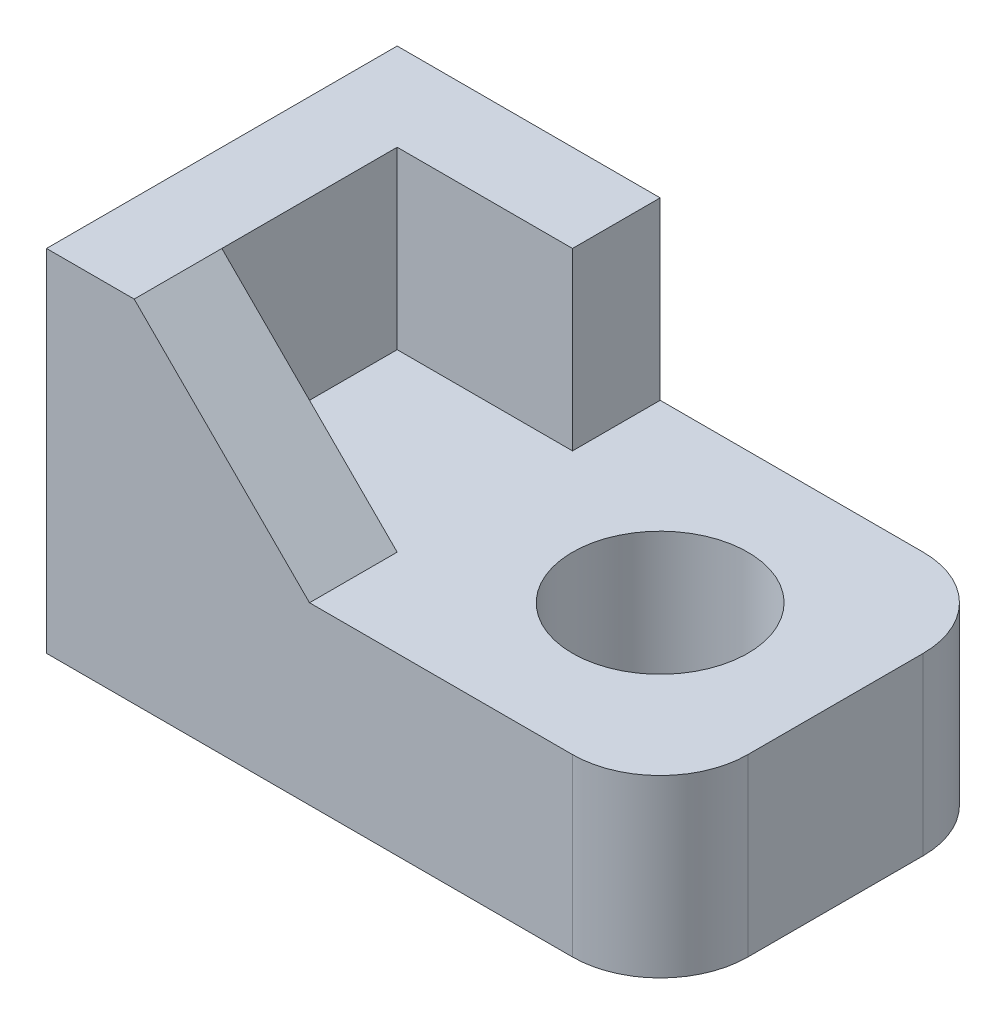
from build123d import *

# Parameters (mm, degrees)
SKETCH_1_W      = 35
SKETCH_1_H      = 20
SKETCH_1_R      = 5
EXTRUDE_1_DEPTH = 10
SKETCH_2_W      = 5
SKETCH_2_H      = 5
SKETCH_2_H_2    = 15
SKETCH_2_W_2    = 10
EXTRUDE_2_DEPTH = 10
EXTRUDE_3_DEPTH = 5
FILLET_1_R      = 5


with BuildPart() as part:
    # 草圖1 → 填料-伸長1 (new body)
    with BuildSketch(Plane(origin=(0, 0, 0), x_dir=(1, 0, 0), z_dir=(0, 1, 0))):
        with Locations((-7.5, 0)):
            Rectangle(SKETCH_1_W, SKETCH_1_H)
        with Locations(Location((0, 0, 0), (0, 0, 270))):
            Circle(SKETCH_1_R, mode=Mode.SUBTRACT)
    extrude(amount=EXTRUDE_1_DEPTH)

    # 草圖2 → 填料-伸長2 (add)
    with BuildSketch(Plane(origin=(0, 10, 0), x_dir=(1, 0, 0), z_dir=(0, 1, 0))):
        with Locations((-22.5, 7.5)):
            Rectangle(SKETCH_2_W, SKETCH_2_H)
        with Locations((-22.5, -2.5)):
            Rectangle(SKETCH_2_W, SKETCH_2_H_2)
        with Locations((-15, 7.5)):
            Rectangle(SKETCH_2_W_2, SKETCH_2_H)
    extrude(amount=EXTRUDE_2_DEPTH)

    # 草圖3 → 填料-伸長3 (add)
    with BuildSketch(Plane.XY.offset(10)):
        Polygon((-10, 10), (-20, 20), (-20, 10), align=None)
    extrude(amount=-EXTRUDE_3_DEPTH)

    # 圓角1
    fillet_1_edges = [part.edges().sort_by_distance(p)[0] for p in [
        (10, 5, 10),
        (10, 5, -10),
    ]]
    fillet(fillet_1_edges, radius=FILLET_1_R)


solid = part.part
